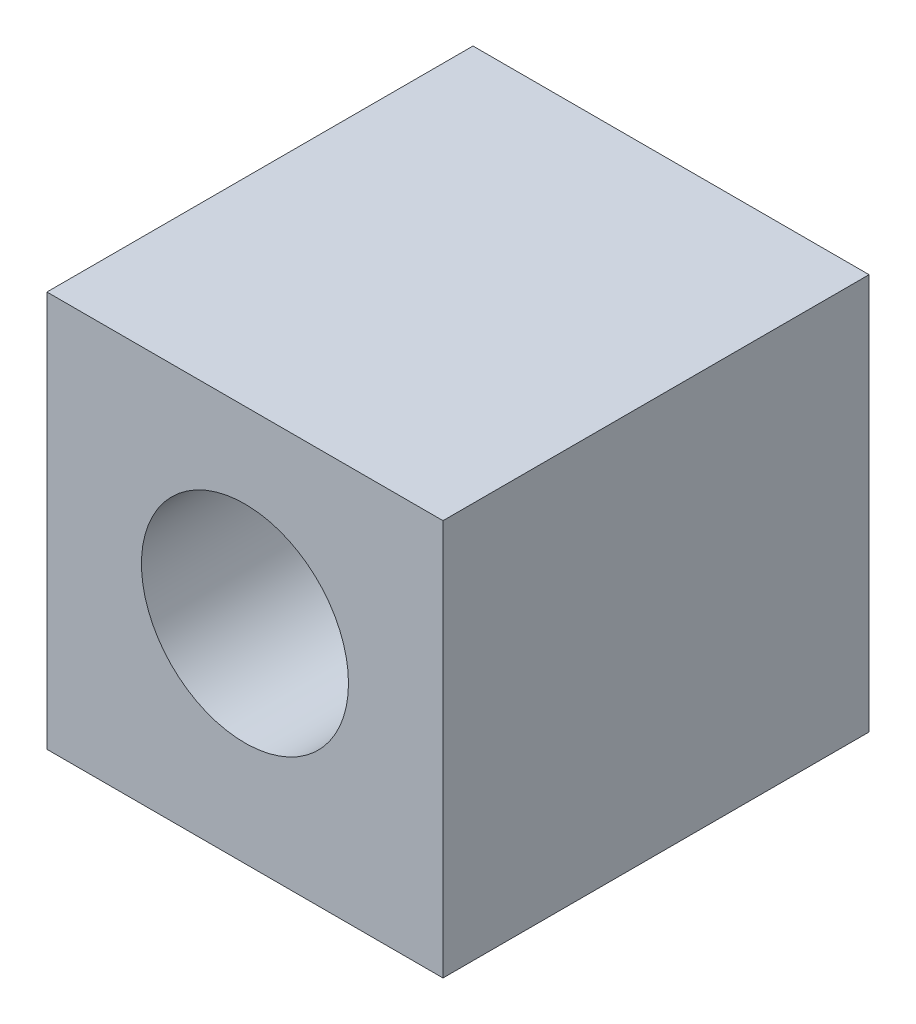
from build123d import *

# Parameters (mm, degrees)
ESQUISSE1_W             = 132
ESQUISSE1_H             = 132
BOSS_EXTRU_1_DEPTH      = 142
ESQUISSE2_R             = 34.5
ENL_V_MAT_EXTRU_1_DEPTH = 142


with BuildPart() as part:
    # Esquisse1 → Boss.-Extru.1 (new body)
    with BuildSketch(Plane.XY):
        with Locations((66, 66)):
            Rectangle(ESQUISSE1_W, ESQUISSE1_H)
    extrude(amount=BOSS_EXTRU_1_DEPTH)

    # Esquisse2 → Enlèv. mat.-Extru.1 (cut)
    with BuildSketch(Plane.XY.offset(142)):
        with Locations((66, 69.326887323)):
            Circle(ESQUISSE2_R)
    extrude(amount=-ENL_V_MAT_EXTRU_1_DEPTH, mode=Mode.SUBTRACT)


solid = part.part
